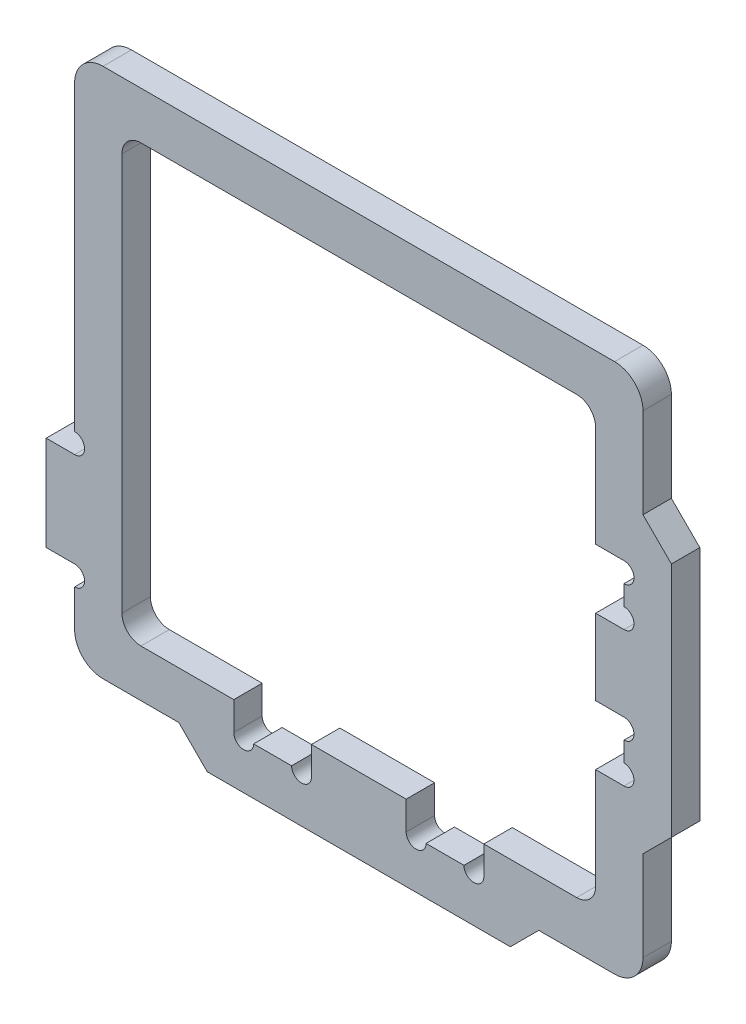
from build123d import *

# Parameters (mm, degrees)
EXTRUDE_1_DEPTH = 3
FILLET_1_R      = 3
FILLET_2_R      = 2


with BuildPart() as part:
    # 草图1 → 凸台-拉伸1 (new body)
    with BuildSketch(Plane.XY):
        with BuildLine():
            Line((-30, -23), (-30, -28))
            Line((-30, -28), (-19, -28))
            Line((-19, -28), (-16, -31))
            Line((-16, -31), (16, -31))
            Line((16, -31), (19, -28))
            Line((19, -28), (30, -28))
            Line((30, -28), (30, -23))
            Line((30, -23), (30, -18))
            Line((30, -18), (30, -15.5))
            Line((30, -15.5), (33, -12.5))
            Line((33, -12.5), (33, 12.5))
            Line((33, 12.5), (30, 15.5))
            Line((30, 15.5), (30, 28))
            Line((30, 28), (-30, 28))
            Line((-30, 28), (-30, -6.9))
            ThreePointArc((-30, -6.9), (-29.25753788, -7.20753788), (-28.95, -7.95))
            ThreePointArc((-28.95, -7.95), (-29.25753788, -8.69246212), (-30, -9))
            Line((-30, -9), (-33, -9))
            Line((-33, -9), (-33, -19))
            Line((-33, -19), (-30, -19))
            ThreePointArc((-30, -19), (-29.25753788, -19.30753788), (-28.95, -20.05))
            ThreePointArc((-28.95, -20.05), (-29.25753788, -20.79246212), (-30, -21.1))
            Line((-30, -21.1), (-30, -23))
        make_face()
        with BuildLine():
            Line((25, -10.3), (25, -23))
            Line((25, -23), (13.2, -23))
            Line((13.2, -23), (13.2, -26))
            ThreePointArc((13.2, -26), (12.15, -27.05), (11.1, -26))
            Line((11.1, -26), (7.1, -26))
            ThreePointArc((7.1, -26), (6.05, -27.05), (5, -26))
            Line((5, -26), (5, -23))
            Line((5, -23), (-5, -23))
            Line((-5, -23), (-5, -26))
            ThreePointArc((-5, -26), (-6.05, -27.05), (-7.1, -26))
            Line((-7.1, -26), (-11.1, -26))
            ThreePointArc((-11.1, -26), (-12.15, -27.05), (-13.2, -26))
            Line((-13.2, -26), (-13.2, -23))
            Line((-13.2, -23), (-25, -23))
            Line((-25, -23), (-25, 23))
            Line((-25, 23), (25, 23))
            Line((25, 23), (25, 10.3))
            Line((25, 10.3), (28, 10.3))
            ThreePointArc((28, 10.3), (28.74246212, 9.99246212), (29.05, 9.25))
            ThreePointArc((29.05, 9.25), (28.74246212, 8.50753788), (28, 8.2))
            Line((28, 8.2), (28, 6.1))
            ThreePointArc((28, 6.1), (28.74246212, 5.79246212), (29.05, 5.05))
            ThreePointArc((29.05, 5.05), (28.74246212, 4.30753788), (28, 4))
            Line((28, 4), (25, 4))
            Line((25, 4), (25, -4))
            Line((25, -4), (28, -4))
            ThreePointArc((28, -4), (28.74246212, -4.30753788), (29.05, -5.05))
            ThreePointArc((29.05, -5.05), (28.74246212, -5.79246212), (28, -6.1))
            Line((28, -6.1), (28, -8.2))
            ThreePointArc((28, -8.2), (28.74246212, -8.50753788), (29.05, -9.25))
            ThreePointArc((29.05, -9.25), (28.74246212, -9.99246212), (28, -10.3))
            Line((28, -10.3), (25, -10.3))
        make_face(mode=Mode.SUBTRACT)
    extrude(amount=EXTRUDE_1_DEPTH)

    # 圆角1
    fillet_1_edges = [part.edges().sort_by_distance(p)[0] for p in [
        (-30, 28, 1.5),
        (30, 28, 1.5),
        (30, -28, 1.5),
        (-30, -28, 1.5),
    ]]
    fillet(fillet_1_edges, radius=FILLET_1_R)

    # 圆角2
    fillet_2_edges = [part.edges().sort_by_distance(p)[0] for p in [
        (25, 23, 1.5),
        (-25, 23, 1.5),
        (-25, -23, 1.5),
        (25, -23, 1.5),
    ]]
    fillet(fillet_2_edges, radius=FILLET_2_R)


solid = part.part
